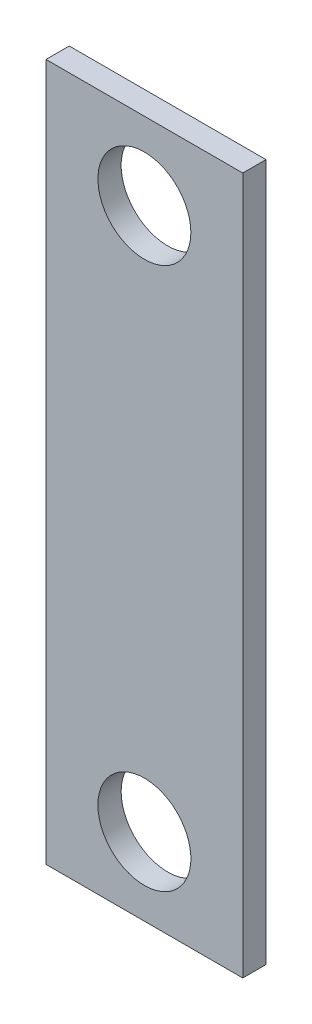
from build123d import *

# Parameters (mm, degrees)
CROQUIS1_W              = 50.8
CROQUIS1_H              = 180
CROQUIS1_R              = 12
SALIENTE_EXTRUIR1_DEPTH = 6


with BuildPart() as part:
    # Croquis1 → Saliente-Extruir1 (new body)
    with BuildSketch(Plane.XY):
        Rectangle(CROQUIS1_W, CROQUIS1_H)
        with Locations((0, 70)):
            Circle(CROQUIS1_R, mode=Mode.SUBTRACT)
        with Locations(Location((0, -70, 0), (0, 0, 180))):
            Circle(CROQUIS1_R, mode=Mode.SUBTRACT)
    extrude(amount=SALIENTE_EXTRUIR1_DEPTH)


solid = part.part
